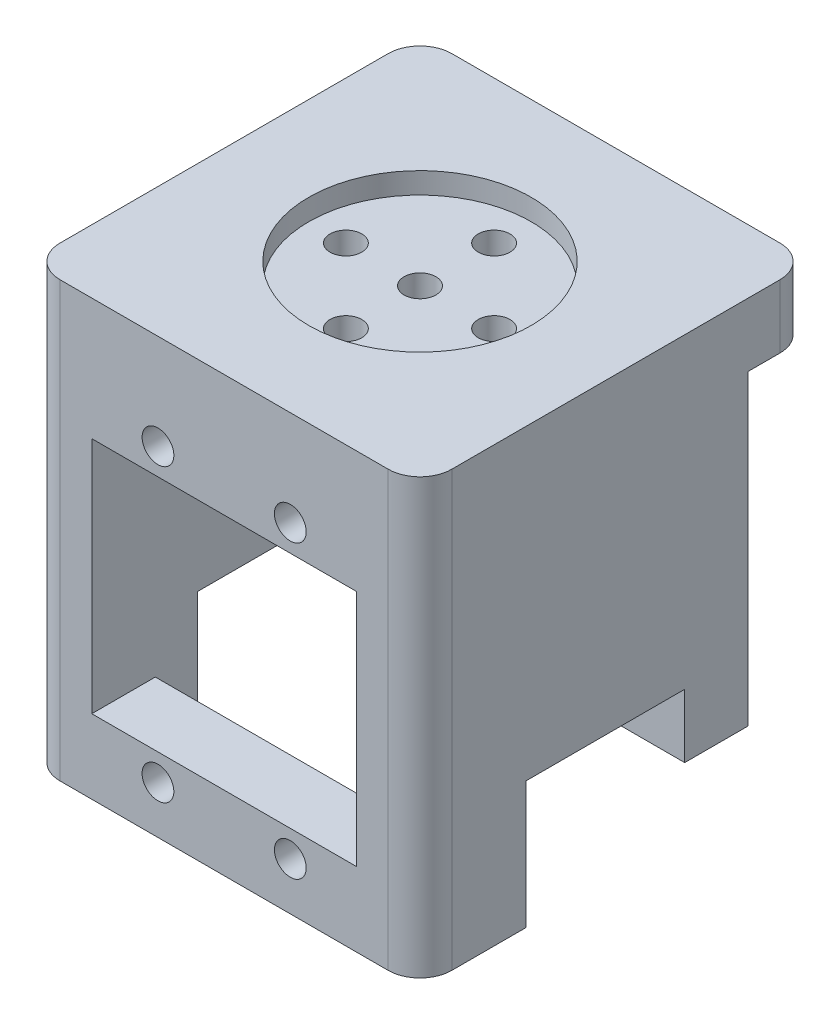
from build123d import *

# Parameters (mm, degrees)
SKETCH4_W           = 25
SKETCH4_H           = 25
BOSS_EXTRUDE1_DEPTH = 35
CUT_EXTRUDE12_DEPTH = 50
SKETCH23_W          = 25
SKETCH23_H          = 22.5
CUT_EXTRUDE13_DEPTH = 7
SKETCH24_W          = 30.861916298
SKETCH24_H          = 6.481730837
BOSS_EXTRUDE6_DEPTH = 2
SKETCH25_R          = 1.5
CUT_EXTRUDE14_DEPTH = 3.5
SKETCH26_R          = 1.5
CUT_EXTRUDE15_DEPTH = 3.5
BOSS_EXTRUDE8_DEPTH = 6
SKETCH28_R          = 1.5
CUT_EXTRUDE16_DEPTH = 10
SKETCH29_R          = 1.5
CUT_EXTRUDE17_DEPTH = 10
SKETCH30_R          = 10.5
CUT_EXTRUDE18_DEPTH = 2


with BuildPart() as part:
    # Sketch4 → Boss-Extrude1 (new body)
    with BuildSketch(Plane(origin=(0, 0, 0), x_dir=(1, 0, 0), z_dir=(0, 1, 0))):
        with BuildLine():
            Line((-14.859531773, 13.748687459), (16.140468227, 13.748687459))
            ThreePointArc((16.140468227, 13.748687459), (18.261788571, 12.870007803), (19.140468227, 10.748687459))
            Line((19.140468227, 10.748687459), (19.140468227, -20.251312541))
            ThreePointArc((19.140468227, -20.251312541), (18.261788571, -22.372632884), (16.140468227, -23.251312541))
            Line((16.140468227, -23.251312541), (-14.859531773, -23.251312541))
            ThreePointArc((-14.859531773, -23.251312541), (-16.980852116, -22.372632884), (-17.859531773, -20.251312541))
            Line((-17.859531773, -20.251312541), (-17.859531773, 10.748687459))
            ThreePointArc((-17.859531773, 10.748687459), (-16.980852116, 12.870007803), (-14.859531773, 13.748687459))
        make_face()
        with Locations((0.640468227, -4.751312541)):
            Rectangle(SKETCH4_W, SKETCH4_H, mode=Mode.SUBTRACT)
    extrude(amount=BOSS_EXTRUDE1_DEPTH)

    # Sketch22 → Cut-Extrude12 (cut)
    with BuildSketch(Plane.ZY.offset(17.859531773)):
        Polygon((-13.748687459, 35), (-13.748687459, 0), (13.251312541, 0), (13.251312541, 12), (-1.748687459, 12), (-1.748687459, 6), (-7.748687459, 6), (-7.748687459, 35), align=None)
    extrude(amount=-CUT_EXTRUDE12_DEPTH, mode=Mode.SUBTRACT)

    # Sketch23 → Cut-Extrude13 (cut)
    with BuildSketch(Plane.XY.offset(23.251312541)):
        with Locations((0.640468227, 18.25)):
            Rectangle(SKETCH23_W, SKETCH23_H)
    extrude(amount=-CUT_EXTRUDE13_DEPTH, mode=Mode.SUBTRACT)

    # Sketch24 → Boss-Extrude6 (add)
    with BuildSketch(Plane.XZ):
        with Locations((1.291847829, 16.49217796)):
            Rectangle(SKETCH24_W, SKETCH24_H)
    extrude(amount=-BOSS_EXTRUDE6_DEPTH)

    # Sketch25 → Cut-Extrude14 (cut)
    with BuildSketch(Plane(origin=(0, 0, -7.748687459), x_dir=(-1, 0, 0), z_dir=(0, 0, -1))):
        with Locations((-16.140468227, 21.5)):
            Circle(SKETCH25_R)
        with Locations((-16.140468227, 17)):
            Circle(SKETCH25_R)
        with Locations((-16.140468227, 12.5)):
            Circle(SKETCH25_R)
        with Locations((14.859531773, 12.5)):
            Circle(SKETCH25_R)
        with Locations((14.859531773, 21.5)):
            Circle(SKETCH25_R)
        with Locations((14.859531773, 17)):
            Circle(SKETCH25_R)
        with Locations((14.859531773, 30.5)):
            Circle(SKETCH25_R)
        with Locations((-16.140468227, 30.5)):
            Circle(SKETCH25_R)
        with Locations((-16.140468227, 26)):
            Circle(SKETCH25_R)
        with Locations((14.859531773, 26)):
            Circle(SKETCH25_R)
    extrude(amount=-CUT_EXTRUDE14_DEPTH, mode=Mode.SUBTRACT)

    # Sketch26 → Cut-Extrude15 (cut)
    with BuildSketch(Plane.XZ.offset(-6)):
        with Locations(Location((-14.859531773, -4.748687459, 0), (0, 0, 270))):
            Circle(SKETCH26_R)
        with Locations(Location((16.140468227, -4.748687459, 0), (0, 0, 270))):
            Circle(SKETCH26_R)
    extrude(amount=-CUT_EXTRUDE15_DEPTH, mode=Mode.SUBTRACT)

    # Sketch27 → Boss-Extrude8 (add)
    with BuildSketch(Plane(origin=(0, 35, 0), x_dir=(1, 0, 0), z_dir=(0, 1, 0))):
        with BuildLine():
            Line((-14.859531773, -23.251312541), (16.140468227, -23.251312541))
            ThreePointArc((16.140468227, -23.251312541), (18.261788571, -22.372632884), (19.140468227, -20.251312541))
            Line((19.140468227, -20.251312541), (19.140468227, 10.748687459))
            ThreePointArc((19.140468227, 10.748687459), (18.261788571, 12.870007803), (16.140468227, 13.748687459))
            Line((16.140468227, 13.748687459), (-14.859531773, 13.748687459))
            ThreePointArc((-14.859531773, 13.748687459), (-16.980852116, 12.870007803), (-17.859531773, 10.748687459))
            Line((-17.859531773, 10.748687459), (-17.859531773, -20.251312541))
            ThreePointArc((-17.859531773, -20.251312541), (-16.980852116, -22.372632884), (-14.859531773, -23.251312541))
        make_face()
    extrude(amount=BOSS_EXTRUDE8_DEPTH)

    # Sketch28 → Cut-Extrude16 (cut)
    with BuildSketch(Plane.XY.offset(23.251312541)):
        with Locations((-5.609531773, 32)):
            Circle(SKETCH28_R)
        with Locations((6.890468227, 32)):
            Circle(SKETCH28_R)
        with Locations((-5.609531773, 4.5)):
            Circle(SKETCH28_R)
        with Locations((6.890468227, 4.5)):
            Circle(SKETCH28_R)
    extrude(amount=-CUT_EXTRUDE16_DEPTH, mode=Mode.SUBTRACT)

    # Sketch29 → Cut-Extrude17 (cut)
    with BuildSketch(Plane(origin=(0, 41, 0), x_dir=(1, 0, 0), z_dir=(0, 1, 0))):
        with Locations(Location((0.640468227, 2.248687459, 0), (0, 0, 270))):
            Circle(SKETCH29_R)
        with Locations(Location((7.640468227, -4.751312541, 0), (0, 0, 270))):
            Circle(SKETCH29_R)
        with Locations(Location((0.640468227, -11.751312541, 0), (0, 0, 270))):
            Circle(SKETCH29_R)
        with Locations(Location((-6.359531773, -4.751312541, 0), (0, 0, 270))):
            Circle(SKETCH29_R)
        with Locations(Location((0.640468227, -4.751312541, 0), (0, 0, 270))):
            Circle(SKETCH29_R)
    extrude(amount=-CUT_EXTRUDE17_DEPTH, mode=Mode.SUBTRACT)

    # Sketch30 → Cut-Extrude18 (cut)
    with BuildSketch(Plane(origin=(0, 41, 0), x_dir=(1, 0, 0), z_dir=(0, 1, 0))):
        with Locations(Location((0.640468227, -4.751312541, 0), (0, 0, 270))):
            Circle(SKETCH30_R)
    extrude(amount=-CUT_EXTRUDE18_DEPTH, mode=Mode.SUBTRACT)


solid = part.part
